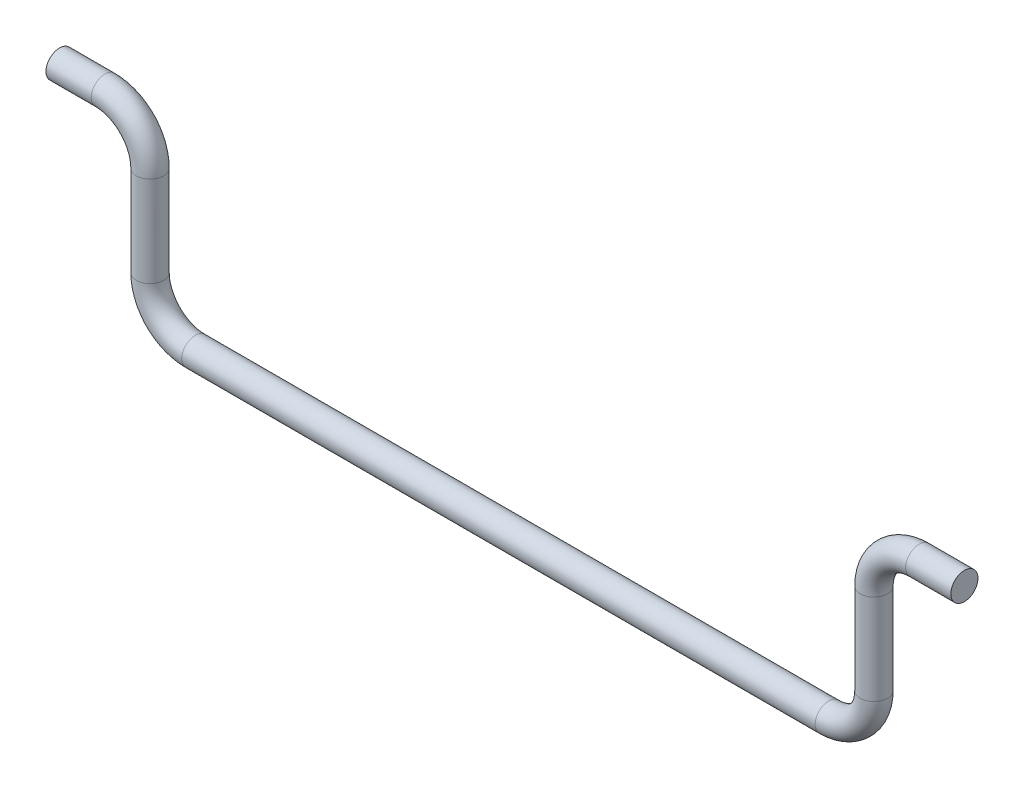
from build123d import *

# Parameters (mm, degrees)
SKETCH2_R = 0.6


with BuildPart() as part:
    # Sweep1: sweep along a path in Sketch1
    with BuildLine(Plane.XY) as sweep1_path:
        Line((0, 0), (2, 0))
        ThreePointArc((2, 0), (3.414213562, -0.585786438), (4, -2))
        Line((4, -2), (4, -6))
        ThreePointArc((4, -6), (4.585786438, -7.414213562), (6, -8))
        Line((6, -8), (34, -8))
        ThreePointArc((34, -8), (35.414213562, -7.414213562), (36, -6))
        Line((36, -6), (36, -2))
        ThreePointArc((36, -2), (36.585786438, -0.585786438), (38, 0))
        Line((38, 0), (40, 0))
    # Sketch2 → Sweep1 (sweep)
    with BuildSketch(Plane(origin=(0, 0, 0), x_dir=(0, 0, -1), z_dir=(1, 0, 0))):
        Circle(SKETCH2_R)
    sweep(path=sweep1_path.line)


solid = part.part
